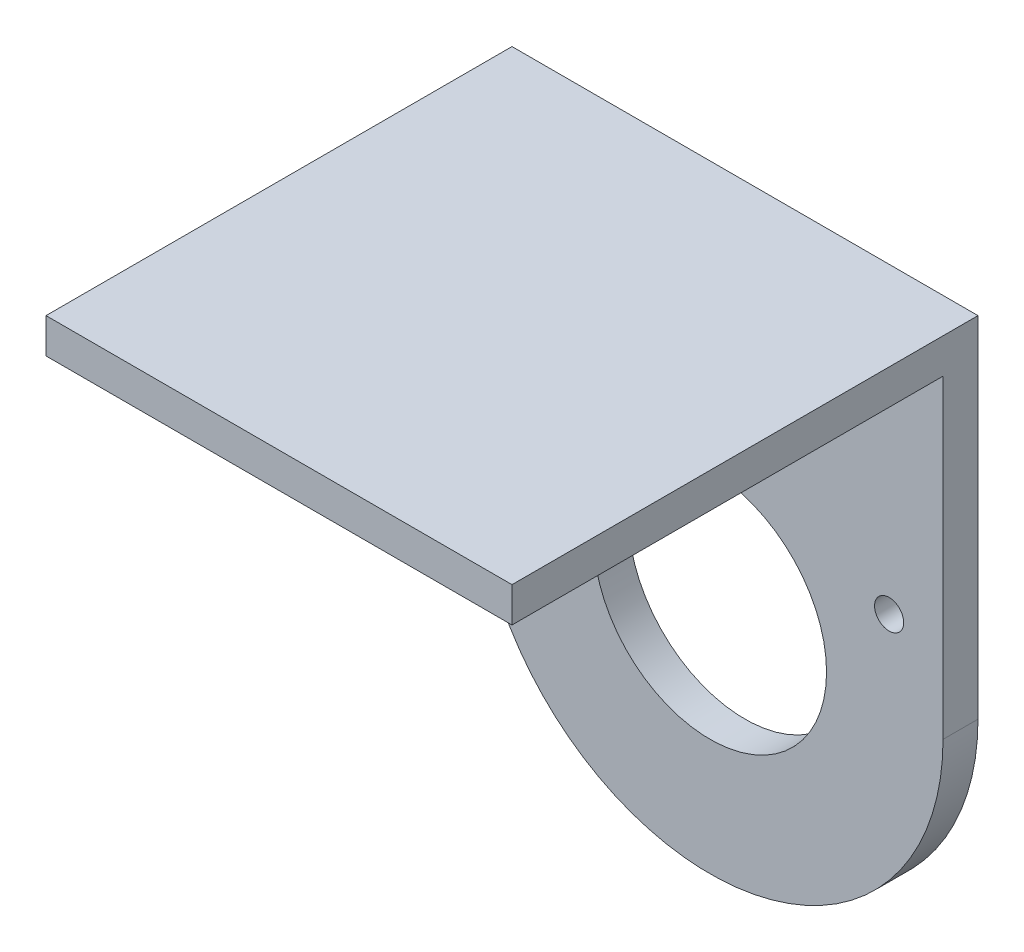
from build123d import *

# Parameters (mm, degrees)
SKETCH_1_R          = 10
EXTRUDE_2_DEPTH     = 40
CUT_EXTRUDE_START   = -37
CUT_EXTRUDE_1_DEPTH = 37
SKETCH_5_R          = 1.25
CUT_EXTRUDE_4_DEPTH = 3
SKETCH_6_R          = 1.25
CUT_EXTRUDE_5_DEPTH = 3
SKETCH_7_R          = 1.25
CUT_EXTRUDE_6_DEPTH = 3
SKETCH_8_R          = 1.25
CUT_EXTRUDE_7_DEPTH = 3


with BuildPart() as part:
    # 草图1 → 凸台-拉伸2 (new body)
    with BuildSketch(Plane.XY):
        with BuildLine():
            Line((-17.553025885, 11.952701951), (22.446974115, 11.952701951))
            Line((22.446974115, 11.952701951), (22.446974115, -18.047298049))
            ThreePointArc((22.446974115, -18.047298049), (2.446974115, -38.047298049), (-17.553025885, -18.047298049))
            Line((-17.553025885, -18.047298049), (-17.553025885, 11.952701951))
        make_face()
        with Locations((2.446974115, -18.047298049)):
            Circle(SKETCH_1_R, mode=Mode.SUBTRACT)
    extrude(amount=EXTRUDE_2_DEPTH)

    # 草图2 → 切除-拉伸1 (cut)
    with BuildSketch(Plane.XY.offset(40).offset(CUT_EXTRUDE_START)):
        with BuildLine():
            Line((-17.553025885, -18.047298049), (-17.553025885, 8.952701951))
            Line((-17.553025885, 8.952701951), (22.446974115, 8.952701951))
            Line((22.446974115, 8.952701951), (22.446974115, -18.047298049))
            ThreePointArc((22.446974115, -18.047298049), (2.446974115, -38.047298049), (-17.553025885, -18.047298049))
        make_face()
    extrude(amount=CUT_EXTRUDE_1_DEPTH, mode=Mode.SUBTRACT)

    # 草图5 → 切除-拉伸4 (cut)
    with BuildSketch(Plane(origin=(0, 0, 0), x_dir=(-1, 0, 0), z_dir=(0, 0, -1))):
        with Locations((-10.066616202, 2.362067463)):
            Circle(SKETCH_5_R)
    extrude(amount=-CUT_EXTRUDE_4_DEPTH, mode=Mode.SUBTRACT)

    # 草图6 → 切除-拉伸5 (cut)
    with BuildSketch(Plane(origin=(0, 0, 0), x_dir=(-1, 0, 0), z_dir=(0, 0, -1))):
        with Locations((5.433383798, 2.362067463)):
            Circle(SKETCH_6_R)
    extrude(amount=-CUT_EXTRUDE_5_DEPTH, mode=Mode.SUBTRACT)

    # 草图7 → 切除-拉伸6 (cut)
    with BuildSketch(Plane(origin=(0, 0, 0), x_dir=(-1, 0, 0), z_dir=(0, 0, -1))):
        with Locations((-17.816616202, -11.061326295)):
            Circle(SKETCH_7_R)
    extrude(amount=-CUT_EXTRUDE_6_DEPTH, mode=Mode.SUBTRACT)

    # 草图8 → 切除-拉伸7 (cut)
    with BuildSketch(Plane(origin=(0, 0, 0), x_dir=(-1, 0, 0), z_dir=(0, 0, -1))):
        with Locations((13.183383798, -11.061326295)):
            Circle(SKETCH_8_R)
    extrude(amount=-CUT_EXTRUDE_7_DEPTH, mode=Mode.SUBTRACT)


solid = part.part
